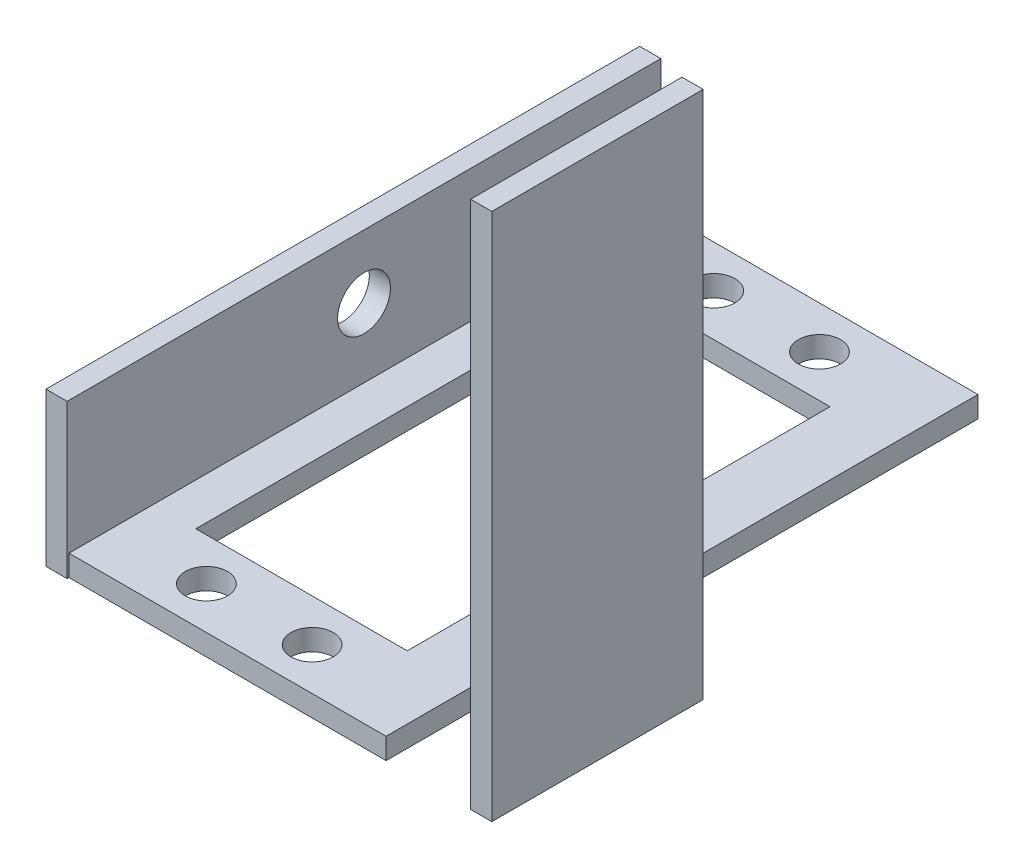
from build123d import *

# Parameters (mm, degrees)
SKETCH1_W             = 20
SKETCH1_H             = 8
SKETCH1_R             = 2
BOSS_EXTRUDE1_DEPTH   = 2
BOSS_EXTRUDE1_2_DEPTH = 2
SKETCH6_W             = 56
SKETCH6_H             = 2
BOSS_EXTRUDE5_DEPTH   = 6
SKETCH10_W            = 56
SKETCH10_H            = 2
BOSS_EXTRUDE7_DEPTH   = 4
SKETCH11_W            = 56.175194469
SKETCH11_H            = 14.528307745
BOSS_EXTRUDE8_DEPTH   = 2
SKETCH12_R            = 2.5
CUT_EXTRUDE3_DEPTH    = 2
SKETCH13_W            = 20
SKETCH13_H            = 50
BOSS_EXTRUDE9_DEPTH   = 2


with BuildPart() as part:
    # Sketch1 → Boss-Extrude1 (new body)
    with BuildSketch(Plane(origin=(0, 0, 0), x_dir=(1, 0, 0), z_dir=(0, 1, 0))):
        with Locations((-0.385906166, -15.501316712)):
            Rectangle(SKETCH1_W, SKETCH1_H)
        with Locations(Location((4.614093834, -15.501316712, 0), (0, 0, 270))):
            Circle(SKETCH1_R, mode=Mode.SUBTRACT)
        with Locations(Location((-5.385906166, -15.501316712, 0), (0, 0, 270))):
            Circle(SKETCH1_R, mode=Mode.SUBTRACT)
    extrude(amount=BOSS_EXTRUDE1_DEPTH)



with BuildPart() as body_2:
    # Sketch1 → Boss-Extrude1 2 (new body)
    with BuildSketch(Plane(origin=(0, 0, 0), x_dir=(1, 0, 0), z_dir=(0, 1, 0))):
        with Locations((-0.385906166, 32.498683288)):
            Rectangle(SKETCH1_W, SKETCH1_H)
        with Locations(Location((4.614093834, 32.498683288, 0), (0, 0, 270))):
            Circle(SKETCH1_R, mode=Mode.SUBTRACT)
        with Locations(Location((-5.385906166, 32.498683288, 0), (0, 0, 270))):
            Circle(SKETCH1_R, mode=Mode.SUBTRACT)
    extrude(amount=BOSS_EXTRUDE1_2_DEPTH)


with BuildPart() as part_1:
    add(part.part)

    add(body_2.part)  # Boss-Extrude5 merges body 2
    # Sketch6 → Boss-Extrude5 (add)
    with BuildSketch(Plane(origin=(9.614093834, 0, 0), x_dir=(0, 0, -1), z_dir=(1, 0, 0))):
        with Locations((8.498683288, 1)):
            Rectangle(SKETCH6_W, SKETCH6_H)
    extrude(amount=BOSS_EXTRUDE5_DEPTH)

    # Sketch10 → Boss-Extrude7 (add)
    with BuildSketch(Plane.ZY.offset(10.385906166)):
        with Locations((-8.498683288, 1)):
            Rectangle(SKETCH10_W, SKETCH10_H)
    extrude(amount=BOSS_EXTRUDE7_DEPTH)

    # Sketch11 → Boss-Extrude8 (add)
    with BuildSketch(Plane.ZY.offset(14.385906166)):
        with Locations((-8.411086054, 7.264153873)):
            Rectangle(SKETCH11_W, SKETCH11_H)
    extrude(amount=BOSS_EXTRUDE8_DEPTH)

    # Sketch12 → Cut-Extrude3 (cut)
    with BuildSketch(Plane.ZY.offset(16.385906166)):
        with Locations((-8.411086053, 8.528307745)):
            Circle(SKETCH12_R)
    extrude(amount=-CUT_EXTRUDE3_DEPTH, mode=Mode.SUBTRACT)

    # Sketch13 → Boss-Extrude9 (add)
    with BuildSketch(Plane(origin=(15.614093834, 0, 0), x_dir=(0, 0, -1), z_dir=(1, 0, 0))):
        with Locations((-1.501316712, 17)):
            Rectangle(SKETCH13_W, SKETCH13_H)
    extrude(amount=BOSS_EXTRUDE9_DEPTH)


solid = part_1.part
